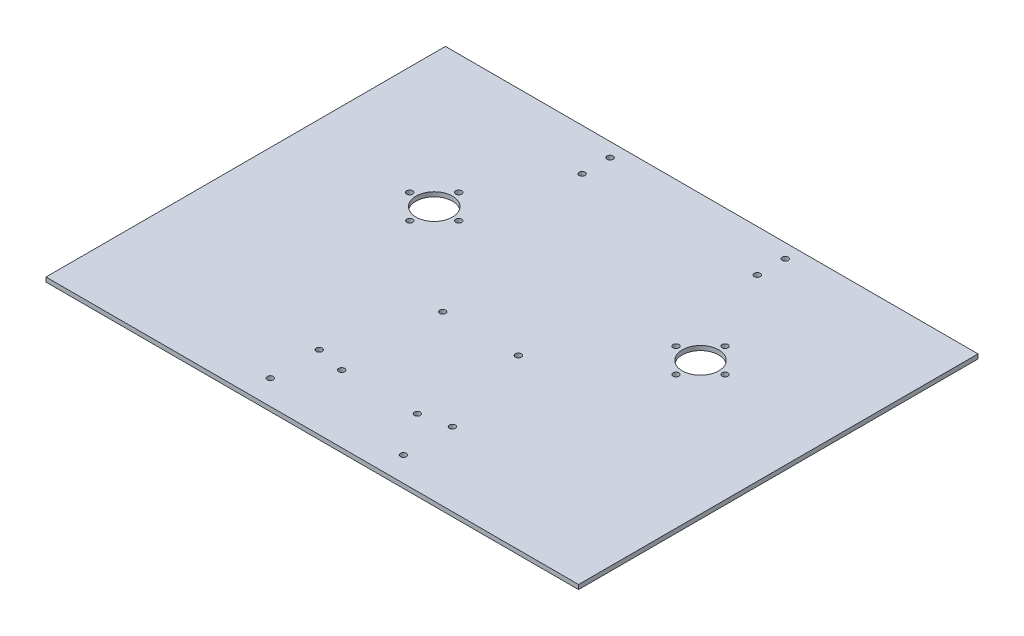
from build123d import *

# Parameters (mm, degrees)
SKETCH1_W           = 380
SKETCH1_H           = 285
SKETCH1_R           = 13
SKETCH1_R_2         = 2.125
BOSS_EXTRUDE1_DEPTH = 3.175


with BuildPart() as part:
    # Sketch1 → Boss-Extrude1 (new body)
    with BuildSketch(Plane(origin=(0, 0, 0), x_dir=(1, 0, 0), z_dir=(0, 1, 0))):
        Rectangle(SKETCH1_W, SKETCH1_H)
        with Locations(Location((-95, 39.5, 0), (0, 0, 270))):
            Circle(SKETCH1_R, mode=Mode.SUBTRACT)
        with Locations(Location((-112.5, 39.5, 0), (0, 0, 270))):
            Circle(SKETCH1_R_2, mode=Mode.SUBTRACT)
        with Locations(Location((-47.5, -125, 0), (0, 0, 270))):
            Circle(SKETCH1_R_2, mode=Mode.SUBTRACT)
        with Locations(Location((-47.5, -90, 0), (0, 0, 270))):
            Circle(SKETCH1_R_2, mode=Mode.SUBTRACT)
        with Locations(Location((-95, 57, 0), (0, 0, 270))):
            Circle(SKETCH1_R_2, mode=Mode.SUBTRACT)
        with Locations(Location((-77.5, 39.5, 0), (0, 0, 270))):
            Circle(SKETCH1_R_2, mode=Mode.SUBTRACT)
        with Locations(Location((-95, 22, 0), (0, 0, 270))):
            Circle(SKETCH1_R_2, mode=Mode.SUBTRACT)
        with Locations(Location((-62.5, 132.5, 0), (0, 0, 270))):
            Circle(SKETCH1_R_2, mode=Mode.SUBTRACT)
        with Locations(Location((-62.5, 112.5, 0), (0, 0, 270))):
            Circle(SKETCH1_R_2, mode=Mode.SUBTRACT)
        with Locations(Location((47.5, -90, 0), (0, 0, 90))):
            Circle(SKETCH1_R_2, mode=Mode.SUBTRACT)
        with Locations(Location((47.5, -125, 0), (0, 0, 90))):
            Circle(SKETCH1_R_2, mode=Mode.SUBTRACT)
        with Locations(Location((95, 22, 0), (0, 0, 90))):
            Circle(SKETCH1_R_2, mode=Mode.SUBTRACT)
        with Locations(Location((77.5, 39.5, 0), (0, 0, 90))):
            Circle(SKETCH1_R_2, mode=Mode.SUBTRACT)
        with Locations(Location((112.5, 39.5, 0), (0, 0, 90))):
            Circle(SKETCH1_R_2, mode=Mode.SUBTRACT)
        with Locations(Location((95, 57, 0), (0, 0, 90))):
            Circle(SKETCH1_R_2, mode=Mode.SUBTRACT)
        with Locations(Location((95, 39.5, 0), (0, 0, 90))):
            Circle(SKETCH1_R, mode=Mode.SUBTRACT)
        with Locations(Location((62.5, 112.5, 0), (0, 0, 90))):
            Circle(SKETCH1_R_2, mode=Mode.SUBTRACT)
        with Locations(Location((62.5, 132.5, 0), (0, 0, 90))):
            Circle(SKETCH1_R_2, mode=Mode.SUBTRACT)
        with Locations(Location((-27, -94.5, 0), (0, 0, 270))):
            Circle(SKETCH1_R_2, mode=Mode.SUBTRACT)
        with Locations(Location((-27, -22.5, 0), (0, 0, 270))):
            Circle(SKETCH1_R_2, mode=Mode.SUBTRACT)
        with Locations(Location((27, -94.5, 0), (0, 0, 90))):
            Circle(SKETCH1_R_2, mode=Mode.SUBTRACT)
        with Locations(Location((27, -22.5, 0), (0, 0, 90))):
            Circle(SKETCH1_R_2, mode=Mode.SUBTRACT)
    extrude(amount=BOSS_EXTRUDE1_DEPTH)


solid = part.part
